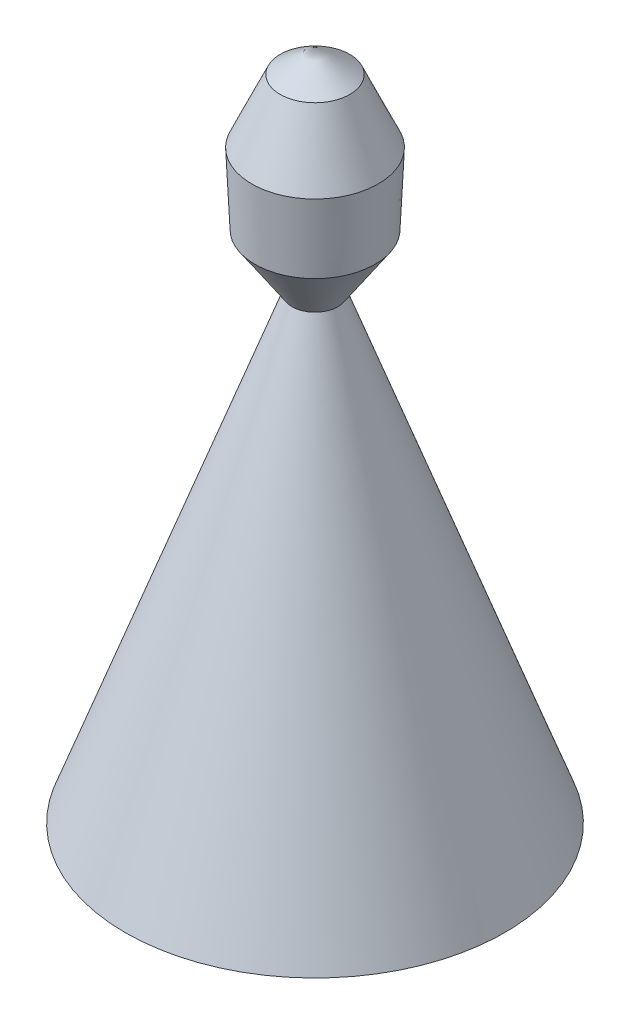
from build123d import *

# Parameters (mm, degrees)
SKETCH2_R   = 21.306312618
SKETCH2_R_2 = 25


with BuildPart() as part:
    # Sketch1 → Revolve1 (revolve)
    with BuildSketch(Plane.XY, mode=Mode.PRIVATE) as revolve1_sk:
        Polygon((0, 4300), (220, 4150), (400, 3750), (380, 3300), (145, 2950), (1200, 50), (1170, 50), (125, 2950), (340, 3300), (340, 3750), (0, 3750), align=None)
    revolve(revolve1_sk.sketch.rotate(Axis((0, 0, 0), (0, 1, 0)), 90), axis=Axis((0, 0, 0), (0, 1, 0)))

    # Sketch2 → Revolve2 (revolve)
    with BuildSketch(Plane.XY, mode=Mode.PRIVATE) as revolve2_sk:
        with Locations((1050, 400)):
            Circle(SKETCH2_R)
        with Locations((820, 1000)):
            Circle(SKETCH2_R_2)
        with Locations((560, 1700)):
            Circle(SKETCH2_R_2)
        with Locations((310, 2400)):
            Circle(SKETCH2_R_2)
    revolve(revolve2_sk.sketch.rotate(Axis((0, 0, 0), (0, 1, 0)), 90), axis=Axis((0, 0, 0), (0, 1, 0)))


solid = part.part
